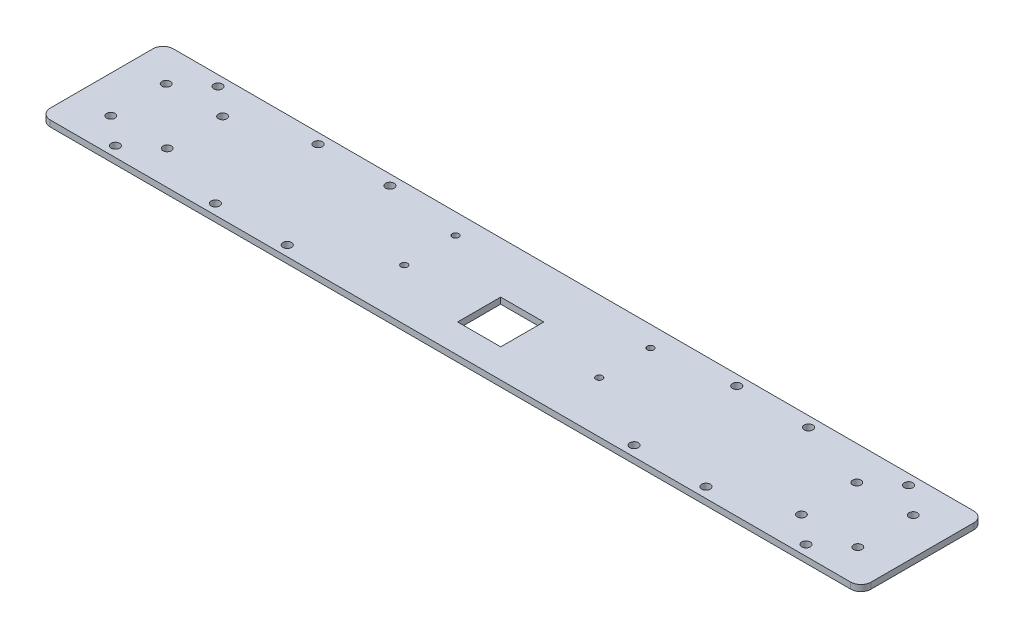
from build123d import *

# Parameters (mm, degrees)
SKETCH_1_W          = 400
SKETCH_1_H          = 60
SKETCH_1_R          = 1.6
SKETCH_1_W_2        = 21
SKETCH_1_H_2        = 21
SKETCH_1_W_3        = 240
SKETCH_1_H_3        = 75
SKETCH_1_R_2        = 20
EXTRUDE_1468_DEPTH  = 3
SKETCH_2_R          = 2.05
SKETCH_2_R_2        = 2.1
CUT_EXTRUDE_1_DEPTH = 250.229009796
FILLET_1_R          = 5
SKETCH1_R           = 2.1
CUT_EXTRUDE4_DEPTH  = 250.229009796
CUT_EXTRUDE_2_DEPTH = 10


with BuildPart() as part:
    # 草图1 → Extrude 1468 (new body)
    # profile 1 of 2: a face of its own
    with BuildSketch(Plane(origin=(0, 0, 0), x_dir=(1, 0, 0), z_dir=(0, 1, 0))):
        with Locations((32.825924772, 16.128249268)):
            Rectangle(SKETCH_1_W, SKETCH_1_H)
        with Locations(Location((-14.674075228, 36.128249268, 0), (0, 0, 270))):
            Circle(SKETCH_1_R, mode=Mode.SUBTRACT)
        with Locations(Location((-14.674075228, 11.128249268, 0), (0, 0, 270))):
            Circle(SKETCH_1_R, mode=Mode.SUBTRACT)
        with Locations(Location((80.325924772, 11.128249268, 0), (0, 0, 270))):
            Circle(SKETCH_1_R, mode=Mode.SUBTRACT)
        with Locations(Location((80.325924772, 36.128249268, 0), (0, 0, 270))):
            Circle(SKETCH_1_R, mode=Mode.SUBTRACT)
        with Locations((32.825924772, 10.628249268)):
            Rectangle(SKETCH_1_W_2, SKETCH_1_H_2, mode=Mode.SUBTRACT)
    # profile 2 of 2: a face of its own
    with BuildSketch(Plane(origin=(0, 0, 0), x_dir=(1, 0, 0), z_dir=(0, 1, 0))):
        with Locations((32.825924772, -51.371750732)):
            Rectangle(SKETCH_1_W_3, SKETCH_1_H_3)
        with Locations(Location((7.825924772, -29.871750732, 0), (0, 0, 270))):
            Circle(SKETCH_1_R, mode=Mode.SUBTRACT)
        with Locations(Location((7.825924772, -79.871750732, 0), (0, 0, 270))):
            Circle(SKETCH_1_R, mode=Mode.SUBTRACT)
        with Locations(Location((57.825924772, -79.871750732, 0), (0, 0, 270))):
            Circle(SKETCH_1_R, mode=Mode.SUBTRACT)
        with Locations(Location((57.825924772, -29.871750732, 0), (0, 0, 270))):
            Circle(SKETCH_1_R, mode=Mode.SUBTRACT)
        with Locations(Location((32.825924772, -54.871750732, 0), (0, 0, 270))):
            Circle(SKETCH_1_R_2, mode=Mode.SUBTRACT)
    extrude(amount=EXTRUDE_1468_DEPTH)

    # 草图2 → 切除-拉伸1 (cut, through all)
    with BuildSketch(Plane(origin=(0, 3, 0), x_dir=(1, 0, 0), z_dir=(0, 1, 0))):
        with Locations(Location((-149.174075228, 29.628249268, 0), (0, 0, 270))):
            Circle(SKETCH_2_R)
        with Locations(Location((-149.174075228, 2.628249268, 0), (0, 0, 270))):
            Circle(SKETCH_2_R)
        with Locations(Location((-121.674075228, 29.628249268, 0), (0, 0, 270))):
            Circle(SKETCH_2_R)
        with Locations(Location((-121.674075228, 2.628249268, 0), (0, 0, 90))):
            Circle(SKETCH_2_R)
        with Locations(Location((-51.674075228, 41.128249268, 0), (0, 0, 270))):
            Circle(SKETCH_2_R_2)
        with Locations(Location((-86.674075228, 41.128249268, 0), (0, 0, 270))):
            Circle(SKETCH_2_R_2)
        with Locations(Location((-51.674075228, -8.871750732, 0), (0, 0, 90))):
            Circle(SKETCH_2_R_2)
        with Locations(Location((-86.674075228, -8.871750732, 0), (0, 0, 90))):
            Circle(SKETCH_2_R_2)
        with Locations(Location((-135.424075228, 41.128249268, 0), (0, 0, 270))):
            Circle(SKETCH_2_R_2)
        with Locations(Location((-135.424075228, -8.871750732, 0), (0, 0, 90))):
            Circle(SKETCH_2_R_2)
        with Locations(Location((201.075924772, -8.871750732, 0), (0, 0, 270))):
            Circle(SKETCH_2_R_2)
        with Locations(Location((201.075924772, 41.128249268, 0), (0, 0, 90))):
            Circle(SKETCH_2_R_2)
        with Locations(Location((152.325924772, -8.871750732, 0), (0, 0, 270))):
            Circle(SKETCH_2_R_2)
        with Locations(Location((117.325924772, -8.871750732, 0), (0, 0, 270))):
            Circle(SKETCH_2_R_2)
        with Locations(Location((152.325924772, 41.128249268, 0), (0, 0, 90))):
            Circle(SKETCH_2_R_2)
        with Locations(Location((117.325924772, 41.128249268, 0), (0, 0, 90))):
            Circle(SKETCH_2_R_2)
        with Locations(Location((187.325924772, 2.628249268, 0), (0, 0, 270))):
            Circle(SKETCH_2_R)
        with Locations(Location((187.325924772, 29.628249268, 0), (0, 0, 90))):
            Circle(SKETCH_2_R)
        with Locations(Location((214.825924772, 2.628249268, 0), (0, 0, 90))):
            Circle(SKETCH_2_R)
        with Locations(Location((214.825924772, 29.628249268, 0), (0, 0, 90))):
            Circle(SKETCH_2_R)
    extrude(amount=-CUT_EXTRUDE_1_DEPTH, mode=Mode.SUBTRACT)

    # 圆角1
    fillet_1_edges = [part.edges().sort_by_distance(p)[0] for p in [
        (-167.174075228, 1.5, 13.871750732),
        (-167.174075228, 1.5, -46.128249268),
        (232.825924772, 1.5, -46.128249268),
        (232.825924772, 1.5, 13.871750732),
        (152.825924772, 1.5, 13.871750732),
        (152.825924772, 1.5, 88.871750732),
        (-87.174075228, 1.5, 88.871750732),
        (-87.174075228, 1.5, 13.871750732),
    ]]
    fillet(fillet_1_edges, radius=FILLET_1_R)

    # Sketch1 → Cut-Extrude4 (cut, through all)
    with BuildSketch(Plane(origin=(0, 0, 0), x_dir=(1, 0, 0), z_dir=(0, 1, 0))):
        with Locations(Location((-72.174075228, -33.871750732, 0), (0, 0, 270))):
            Circle(SKETCH1_R)
        with Locations(Location((-72.174075228, -68.871750732, 0), (0, 0, 270))):
            Circle(SKETCH1_R)
        with Locations(Location((137.825924772, -68.871750732, 0), (0, 0, 90))):
            Circle(SKETCH1_R)
        with Locations(Location((137.825924772, -33.871750732, 0), (0, 0, 90))):
            Circle(SKETCH1_R)
        with BuildLine():
            Line((-42.174075228, -68.871750732), (-42.174075228, -33.871750732))
            ThreePointArc((-42.174075228, -33.871750732), (-32.174075228, -23.871750732), (-22.174075228, -33.871750732))
            Line((-22.174075228, -33.871750732), (-22.174075228, -68.871750732))
            ThreePointArc((-22.174075228, -68.871750732), (-32.174075228, -78.871750732), (-42.174075228, -68.871750732))
        make_face()
        with BuildLine():
            Line((107.825924772, -68.871750732), (107.825924772, -33.871750732))
            ThreePointArc((107.825924772, -33.871750732), (97.825924772, -23.871750732), (87.825924772, -33.871750732))
            Line((87.825924772, -33.871750732), (87.825924772, -68.871750732))
            ThreePointArc((87.825924772, -68.871750732), (97.825924772, -78.871750732), (107.825924772, -68.871750732))
        make_face()
    extrude(amount=CUT_EXTRUDE4_DEPTH, mode=Mode.SUBTRACT)

    # 草图3 → 切除-拉伸2 (cut)
    with BuildSketch(Plane(origin=(0, 3, 0), x_dir=(1, 0, 0), z_dir=(0, 1, 0))):
        with BuildLine():
            ThreePointArc((157.825924772, -13.871750732), (154.290390866, -15.336216826), (152.825924772, -18.871750732))
            Line((152.825924772, -18.871750732), (152.825924772, -83.871750732))
            ThreePointArc((152.825924772, -83.871750732), (151.361458678, -87.407284637), (147.825924772, -88.871750732))
            Line((147.825924772, -88.871750732), (-82.174075228, -88.871750732))
            ThreePointArc((-82.174075228, -88.871750732), (-85.709609134, -87.407284637), (-87.174075228, -83.871750732))
            Line((-87.174075228, -83.871750732), (-87.174075228, -18.871750732))
            ThreePointArc((-87.174075228, -18.871750732), (-88.638541322, -15.336216826), (-92.174075228, -13.871750732))
            Line((-92.174075228, -13.871750732), (157.825924772, -13.871750732))
        make_face()
    extrude(amount=-CUT_EXTRUDE_2_DEPTH, mode=Mode.SUBTRACT)


solid = part.part
